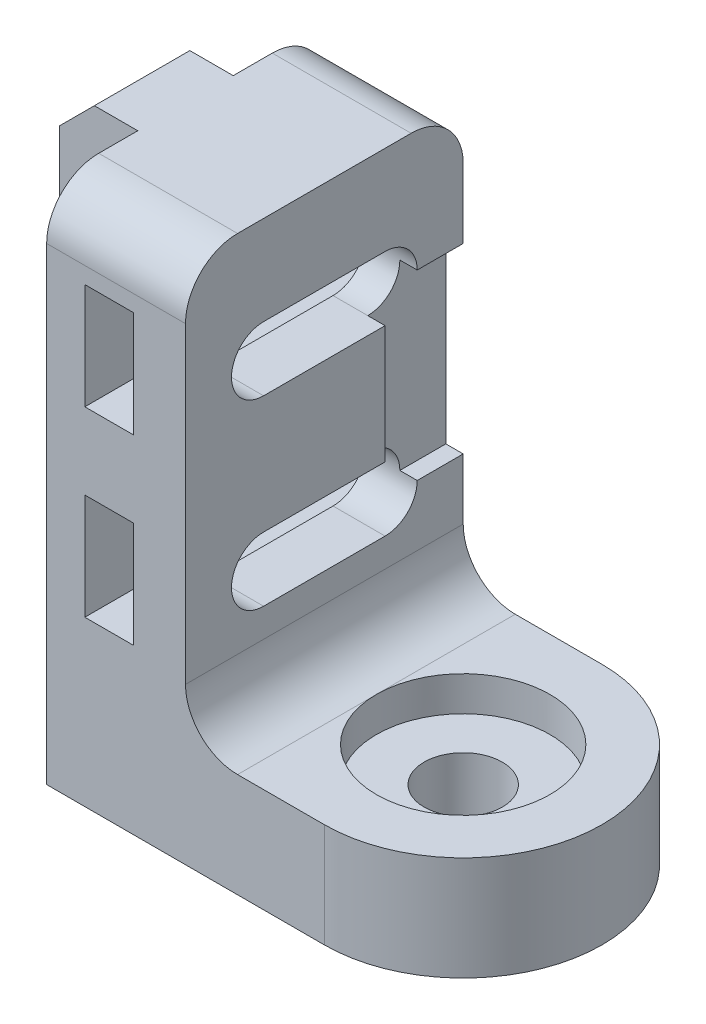
from build123d import *

# Parameters (mm, degrees)
SKETCH1_W           = 16
SKETCH1_H           = 30
BOSS_EXTRUDE1_DEPTH = 8
SKETCH2_W           = 5.5
SKETCH2_H           = 30
BOSS_EXTRUDE2_DEPTH = 4.5
CHAMFER1_SIZE       = 2
SKETCH6_R           = 2.25
BOSS_EXTRUDE3_DEPTH = 6
FILLET6_R           = 3
CUT_EXTRUDE1_START  = -3
SKETCH7_W           = 16
SKETCH7_H           = 6.1
CUT_EXTRUDE1_DEPTH  = 2.8
CUT_EXTRUDE2_DEPTH  = 5
SKETCH9_W           = 4.5
SKETCH9_H           = 10.5
CUT_EXTRUDE3_DEPTH  = 1
SKETCH10_R          = 5
CUT_EXTRUDE4_DEPTH  = 2
FILLET7_R           = 3


with BuildPart() as part:
    # Sketch1 → Boss-Extrude1 (new body)
    with BuildSketch(Plane(origin=(0, 0, 0), x_dir=(0, 0, -1), z_dir=(1, 0, 0))):
        with Locations((-40.846556001, 12.91146402)):
            Rectangle(SKETCH1_W, SKETCH1_H)
    extrude(amount=BOSS_EXTRUDE1_DEPTH)

    # Sketch2 → Boss-Extrude2 (add)
    with BuildSketch(Plane.ZY):
        with Locations((40.846556001, 12.91146402)):
            Rectangle(SKETCH2_W, SKETCH2_H)
    extrude(amount=BOSS_EXTRUDE2_DEPTH)

    # Chamfer1
    chamfer1_edges = [part.edges().sort_by_distance(p)[0] for p in [
        (-4.5, -2.08853598, 40.846556001),
        (-4.5, 27.91146402, 40.846556001),
    ]]
    chamfer(chamfer1_edges, length=CHAMFER1_SIZE)

    # Sketch6 → Boss-Extrude3 (add)
    with BuildSketch(Plane.XZ.offset(2.08853598)):
        with BuildLine():
            Line((8, 48.846556001), (16, 48.846556001))
            ThreePointArc((16, 48.846556001), (24, 40.846556001), (16, 32.846556001))
            Line((16, 32.846556001), (8, 32.846556001))
            Line((8, 32.846556001), (8, 48.846556001))
        make_face()
        with Locations(Location((16, 40.846556001, 0), (0, 0, 270))):
            Circle(SKETCH6_R, mode=Mode.SUBTRACT)
    extrude(amount=-BOSS_EXTRUDE3_DEPTH)

    # Fillet6
    fillet6_edges = [part.edges().sort_by_distance(p)[0] for p in [
        (8, 3.91146402, 40.846556001),
    ]]
    fillet(fillet6_edges, radius=FILLET6_R)

    # Sketch7 → Cut-Extrude1 (cut)
    with BuildSketch(Plane(origin=(8, 0, 0), x_dir=(0, 0, -1), z_dir=(1, 0, 0)).offset(CUT_EXTRUDE1_START)):
        with Locations((-40.846556001, 20.91146402)):
            Rectangle(SKETCH7_W, SKETCH7_H)
        with Locations((-40.846556001, 10.41146402)):
            Rectangle(SKETCH7_W, SKETCH7_H)
    extrude(amount=-CUT_EXTRUDE1_DEPTH, mode=Mode.SUBTRACT)

    # Sketch8 → Cut-Extrude2 (cut)
    with BuildSketch(Plane(origin=(8, 0, 0), x_dir=(0, 0, -1), z_dir=(1, 0, 0))):
        with BuildLine():
            Line((-44.346556001, 22.76146402), (-37.346556001, 22.76146402))
            ThreePointArc((-37.346556001, 22.76146402), (-35.496556001, 20.91146402), (-37.346556001, 19.06146402))
            Line((-37.346556001, 19.06146402), (-44.346556001, 19.06146402))
            ThreePointArc((-44.346556001, 19.06146402), (-46.196556001, 20.91146402), (-44.346556001, 22.76146402))
        make_face()
        with BuildLine():
            Line((-44.346556001, 12.26146402), (-37.346556001, 12.26146402))
            ThreePointArc((-37.346556001, 12.26146402), (-35.496556001, 10.41146402), (-37.346556001, 8.56146402))
            Line((-37.346556001, 8.56146402), (-44.346556001, 8.56146402))
            ThreePointArc((-44.346556001, 8.56146402), (-46.196556001, 10.41146402), (-44.346556001, 12.26146402))
        make_face()
    extrude(amount=-CUT_EXTRUDE2_DEPTH, mode=Mode.SUBTRACT)

    # Sketch9 → Cut-Extrude3 (cut)
    with BuildSketch(Plane(origin=(8, 0, 0), x_dir=(0, 0, -1), z_dir=(1, 0, 0))):
        with Locations((-35.096556001, 15.66146402)):
            Rectangle(SKETCH9_W, SKETCH9_H)
    extrude(amount=-CUT_EXTRUDE3_DEPTH, mode=Mode.SUBTRACT)

    # Sketch10 → Cut-Extrude4 (cut)
    with BuildSketch(Plane(origin=(0, 3.91146402, 0), x_dir=(1, 0, 0), z_dir=(0, 1, 0))):
        with Locations(Location((16, -40.846556001, 0), (0, 0, 270))):
            Circle(SKETCH10_R)
    extrude(amount=-CUT_EXTRUDE4_DEPTH, mode=Mode.SUBTRACT)

    # Fillet7
    fillet7_edges = [part.edges().sort_by_distance(p)[0] for p in [
        (4, 27.91146402, 32.846556001),
        (4, 27.91146402, 48.846556001),
    ]]
    fillet(fillet7_edges, radius=FILLET7_R)


solid = part.part
